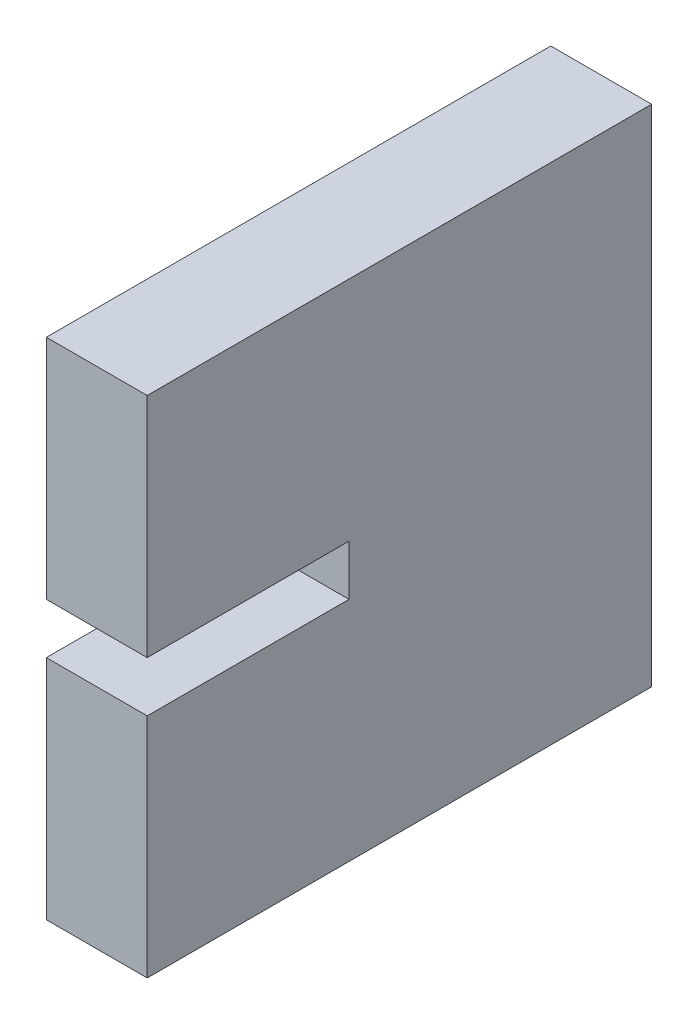
from build123d import *

# Parameters (mm, degrees)
BOSS_EXTRUDE1_DEPTH = 20


with BuildPart() as part:
    # Sketch1 → Boss-Extrude1 (new body)
    with BuildSketch(Plane(origin=(0, 0, 0), x_dir=(0, 0, -1), z_dir=(1, 0, 0))):
        Polygon((-50, 5), (-10, 5), (-10, -5), (-50, -5), (-50, -50), (50, -50), (50, 50), (-50, 50), align=None)
    extrude(amount=BOSS_EXTRUDE1_DEPTH)


solid = part.part
